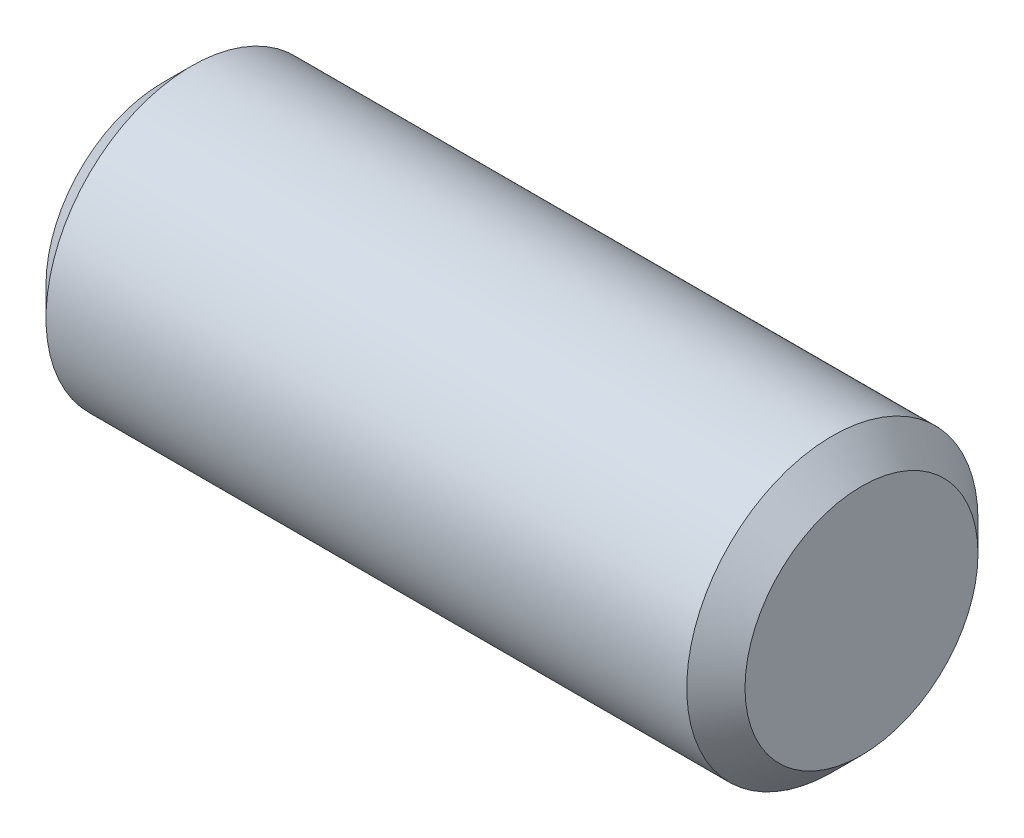
from build123d import *

# Parameters (mm, degrees)
SKETCH2_R           = 2.5
BOSS_EXTRUDE1_DEPTH = 6
CHAMFER2_SIZE       = 0.5


with BuildPart() as part:
    # Sketch2 → Boss-Extrude1 (new, symmetric)
    with BuildSketch(Plane(origin=(0, 0, 0), x_dir=(0, 0, -1), z_dir=(1, 0, 0))):
        Circle(SKETCH2_R)
    extrude(amount=BOSS_EXTRUDE1_DEPTH, both=True)

    # Chamfer2
    chamfer2_edges = [part.edges().sort_by_distance(p)[0] for p in [
        (6, 0, 2.5),
        (-6, 0, 2.5),
    ]]
    chamfer(chamfer2_edges, length=CHAMFER2_SIZE)


solid = part.part
